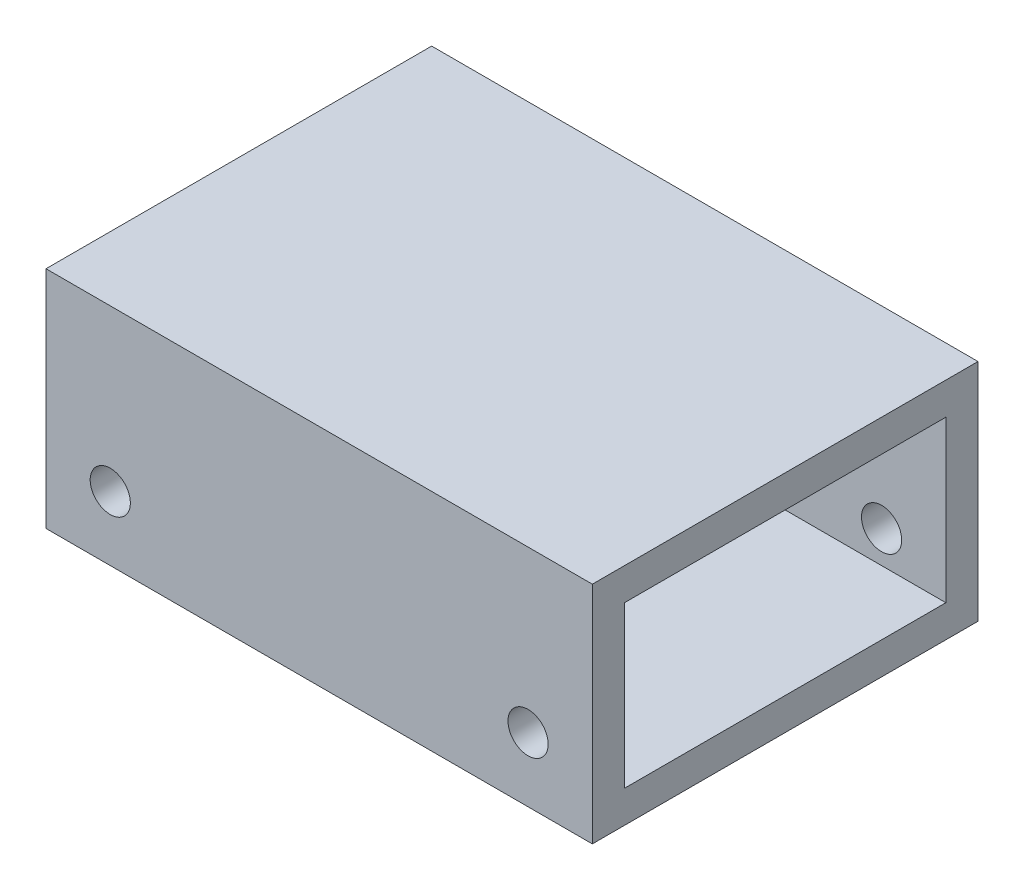
from build123d import *

# Parameters (mm, degrees)
SKETCH1_W                    = 215.9
SKETCH1_H                    = 152.4
BOSS_EXTRUDE1_DEPTH          = 88.9
F_5_8_0_625_DIAMETER_HOLE1_D = 15.875
SKETCH9_W                    = 127
SKETCH9_H                    = 63.5
CUT_EXTRUDE1_DEPTH           = 279.822129681


with BuildPart() as part:
    # Sketch1 → Boss-Extrude1 (new body)
    with BuildSketch(Plane(origin=(0, 0, 0), x_dir=(1, 0, 0), z_dir=(0, 1, 0))):
        with Locations((-107.95, 76.2)):
            Rectangle(SKETCH1_W, SKETCH1_H)
    extrude(amount=BOSS_EXTRUDE1_DEPTH)

    # 5/8 (0.625) Diameter Hole1 (through all)
    with Locations(Plane.XY):
        with Locations((-190.5, 25.4), (-25.4, 25.4)):
            Hole(F_5_8_0_625_DIAMETER_HOLE1_D / 2)

    # Sketch9 → Cut-Extrude1 (cut, through all)
    with BuildSketch(Plane(origin=(0, 0, 0), x_dir=(0, 0, -1), z_dir=(1, 0, 0))):
        with Locations((76.2, 44.45)):
            Rectangle(SKETCH9_W, SKETCH9_H)
    extrude(amount=-CUT_EXTRUDE1_DEPTH, mode=Mode.SUBTRACT)


solid = part.part
